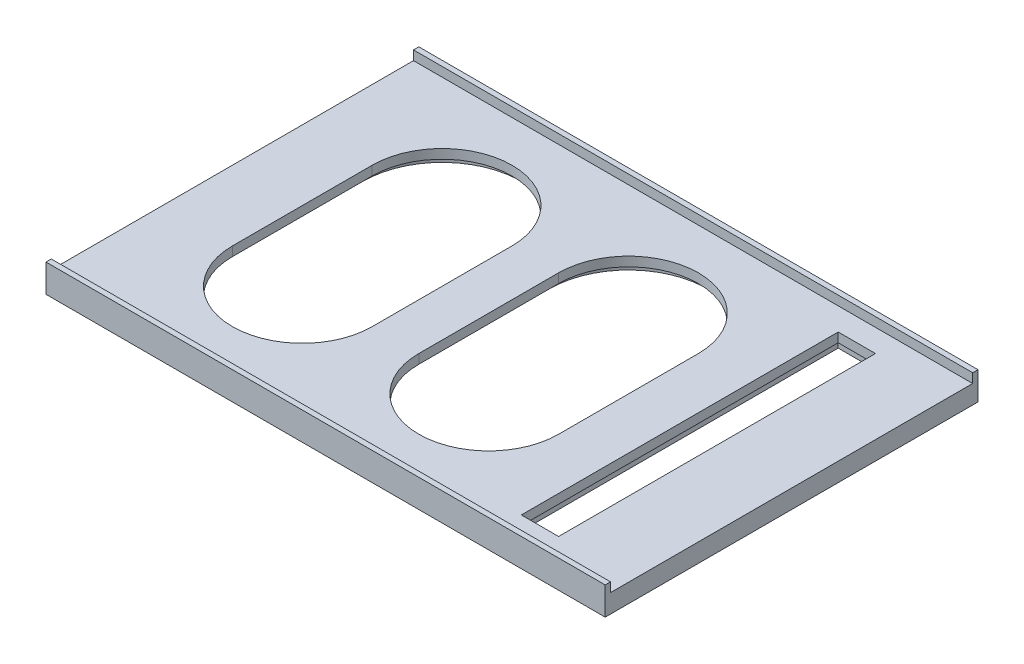
from build123d import *

# Parameters (mm, degrees)
SKETCH_1_W             = 600
SKETCH_1_H             = 400
EXTRUDE_1_DEPTH        = 30
SKETCH_2_W             = 600
SKETCH_2_H             = 388.6
CUT_EXTRUDE_1_DEPTH    = 10
SKETCH_3_W             = 50
SKETCH_3_H             = 350
CUT_EXTRUDE_2_DEPTH    = 10
SKETCH_4_W             = 40
SKETCH_4_H             = 340
CUT_EXTRUDE_3_DEPTH    = 10
HOLE_WIZARD_M6_1_D     = 5
HOLE_WIZARD_M6_1_DEPTH = 14
HOLE_WIZARD_M6_1_TIP   = 1.502151548


with BuildPart() as part:
    # 草图1 → 凸台-拉伸1 (new body)
    with BuildSketch(Plane(origin=(0, 0, 0), x_dir=(1, 0, 0), z_dir=(0, 1, 0))):
        Rectangle(SKETCH_1_W, SKETCH_1_H)
    extrude(amount=EXTRUDE_1_DEPTH)

    # 草图2 → 切除-拉伸1 (cut)
    with BuildSketch(Plane(origin=(0, 30, 0), x_dir=(1, 0, 0), z_dir=(0, 1, 0))):
        Rectangle(SKETCH_2_W, SKETCH_2_H)
    extrude(amount=-CUT_EXTRUDE_1_DEPTH, mode=Mode.SUBTRACT)

    # 草图3 → 切除-拉伸2 (cut)
    with BuildSketch(Plane.XZ):
        with Locations((200, 0)):
            Rectangle(SKETCH_3_W, SKETCH_3_H)
        with BuildLine():
            Line((-235, 75), (-235, -75))
            ThreePointArc((-235, -75), (-150, -160), (-65, -75))
            Line((-65, -75), (-65, 75))
            ThreePointArc((-65, 75), (-150, 160), (-235, 75))
        make_face()
        with BuildLine():
            Line((-35, 75), (-35, -75))
            ThreePointArc((-35, -75), (50, -160), (135, -75))
            Line((135, -75), (135, 75))
            ThreePointArc((135, 75), (50, 160), (-35, 75))
        make_face()
    extrude(amount=-CUT_EXTRUDE_2_DEPTH, mode=Mode.SUBTRACT)

    # 草图4 → 切除-拉伸3 (cut)
    with BuildSketch(Plane.XZ.offset(-10)):
        with Locations((200, 0)):
            Rectangle(SKETCH_4_W, SKETCH_4_H)
        with BuildLine():
            Line((-225, 75), (-225, -75))
            ThreePointArc((-225, -75), (-150, -150), (-75, -75))
            Line((-75, -75), (-75, 75))
            ThreePointArc((-75, 75), (-150, 150), (-225, 75))
        make_face()
        with BuildLine():
            Line((-25, 75), (-25, -75))
            ThreePointArc((-25, -75), (50, -150), (125, -75))
            Line((125, -75), (125, 75))
            ThreePointArc((125, 75), (50, 150), (-25, 75))
        make_face()
    extrude(amount=-CUT_EXTRUDE_3_DEPTH, mode=Mode.SUBTRACT)

    # M6 螺纹孔1
    with Locations(Plane(origin=(0, 0, 0), x_dir=(-1, 0, 0), z_dir=(0, -1, 0))):
        with Locations((285, -183.68), (0, -183.68), (-285, -183.68), (-285, 183.68), (0, 183.68), (285, 183.68)):
            Hole(HOLE_WIZARD_M6_1_D / 2, depth=HOLE_WIZARD_M6_1_DEPTH)
            with Locations((0, 0, -(HOLE_WIZARD_M6_1_DEPTH + HOLE_WIZARD_M6_1_TIP / 2))):  # 118° drill point
                Cone(0, HOLE_WIZARD_M6_1_D / 2, HOLE_WIZARD_M6_1_TIP, mode=Mode.SUBTRACT)


solid = part.part
